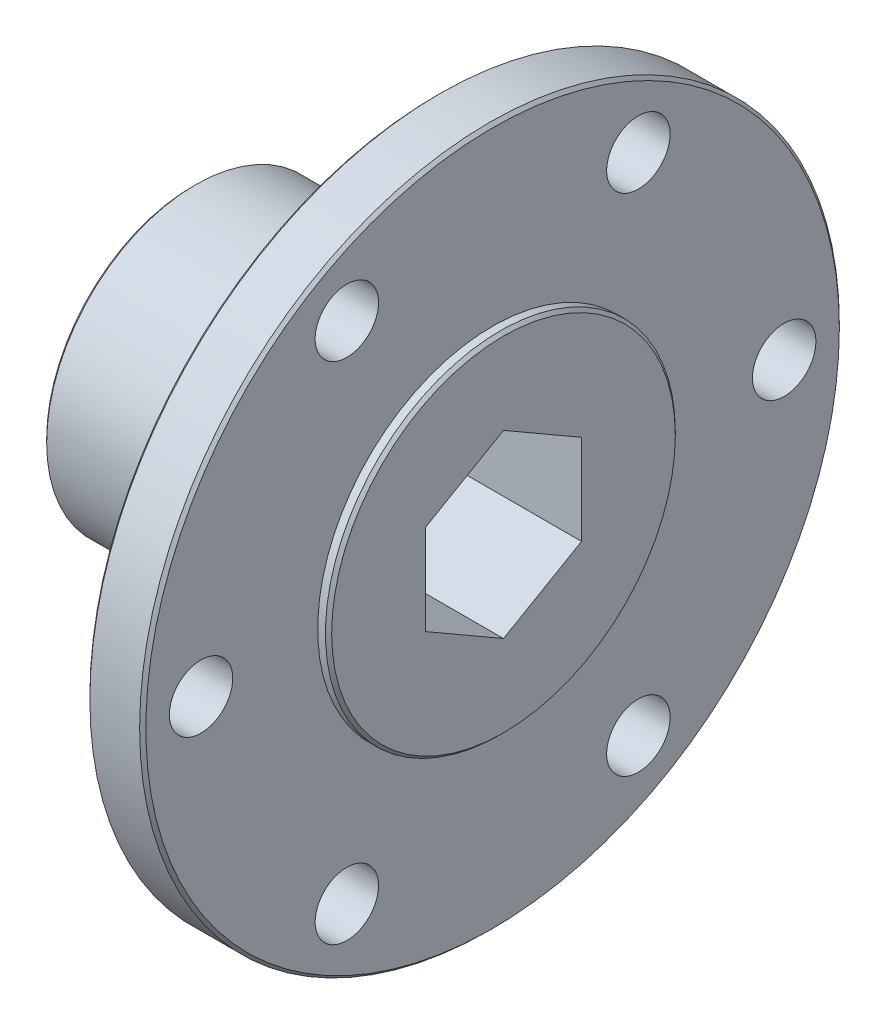
from build123d import *

# Parameters (mm, degrees)
SKETCH2_R          = 2.5908
CUT_EXTRUDE1_DEPTH = 48.2636263
CIRPATTERN1_COUNT  = 6
CUT_EXTRUDE2_DEPTH = 48.730716001
CHAMFER1_SIZE      = 0.254


with BuildPart() as part:
    # Sketch1 → Revolve1 (revolve)
    with BuildSketch(Plane.XY):
        Polygon((-6.014933754, 12.1666), (-6.014933754, 0), (19.385066246, 0), (19.385066246, 14.2875), (18.496066246, 14.2875), (18.496066246, 28.575), (13.924066246, 28.575), (13.924066246, 14.2875), (13.035066246, 14.2875), (13.035066246, 12.9794), (12.222266246, 12.1666), align=None)
    revolve(axis=Axis((-6.014933754, 0, 0), (1, 0, 0)))

    # Sketch2 → Cut-Extrude1 (cut, through all)
    with BuildSketch(Plane(origin=(18.496066246, 0, 0), x_dir=(0, 0, -1), z_dir=(1, 0, 0))):
        with Locations((-11.90625, -20.622229928)):
            Circle(SKETCH2_R)
    cut_extrude1 = extrude(amount=-CUT_EXTRUDE1_DEPTH, mode=Mode.SUBTRACT)

    # CirPattern1: Cut-Extrude1 ×6 about axis
    cirpattern1_axis = Axis((0, 0, 0), (1, 0, 0))
    for i in range(1, CIRPATTERN1_COUNT):
        add(cut_extrude1.rotate(cirpattern1_axis, i * 360 / CIRPATTERN1_COUNT), mode=Mode.SUBTRACT)

    # Sketch3 → Cut-Extrude2 (cut, through all)
    with BuildSketch(Plane(origin=(19.385066246, 0, 0), x_dir=(0, 0, -1), z_dir=(1, 0, 0))):
        Polygon((0, 7.361657812), (-6.3754, 3.680818906), (-6.3754, -3.680858906), (0, -7.361697812), (6.3754, -3.680858906), (6.3754, 3.680818906), align=None)
    extrude(amount=-CUT_EXTRUDE2_DEPTH, mode=Mode.SUBTRACT)

    # Chamfer1
    chamfer1_edges = [part.edges().sort_by_distance(p)[0] for p in [
        (19.385066246, -14.2875, 0),
        (-6.014933754, -12.1666, 0),
        (18.496066246, -28.575, 0),
        (13.035066246, -14.2875, 0),
        (13.924066246, -28.575, 0),
    ]]
    chamfer(chamfer1_edges, length=CHAMFER1_SIZE)


solid = part.part
